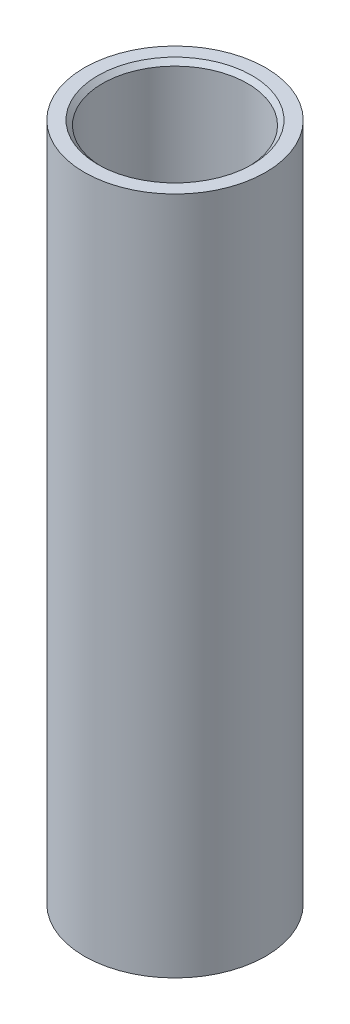
from build123d import *

# Parameters (mm, degrees)
SKETCH1_R           = 3.96875
SKETCH1_R_2         = 3.175
BOSS_EXTRUDE1_DEPTH = 29.718
CHAMFER1_SIZE       = 0.2


with BuildPart() as part:
    # Sketch1 → Boss-Extrude1 (new body)
    with BuildSketch(Plane(origin=(0, 0, 0), x_dir=(1, 0, 0), z_dir=(0, 1, 0))):
        with Locations(Location((0, 0, 0), (0, 0, 270))):
            Circle(SKETCH1_R)
        with Locations(Location((0, 0, 0), (0, 0, 270))):
            Circle(SKETCH1_R_2, mode=Mode.SUBTRACT)
    extrude(amount=BOSS_EXTRUDE1_DEPTH)

    # Chamfer1
    chamfer1_edges = [part.edges().sort_by_distance(p)[0] for p in [
        (0, 0, -3.175),
        (0, 29.718, -3.175),
    ]]
    chamfer(chamfer1_edges, length=CHAMFER1_SIZE)


solid = part.part
